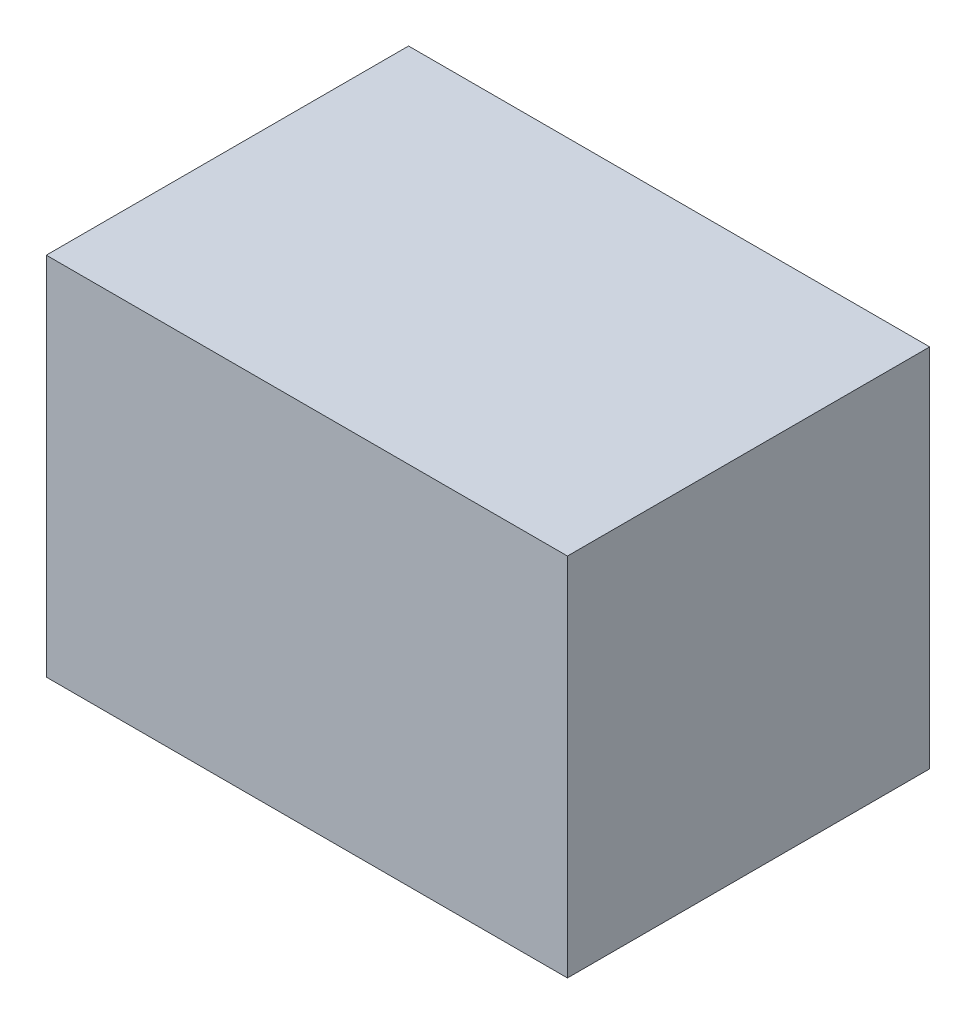
from build123d import *

# Parameters (mm, degrees)
CROQUIS1_W              = 16.4
CROQUIS1_H              = 11.4
SALIENTE_EXTRUIR2_DEPTH = 11.5


with BuildPart() as part:
    # Croquis1 → Saliente-Extruir2 (new body)
    with BuildSketch(Plane(origin=(0, 0, 0), x_dir=(1, 0, 0), z_dir=(0, 1, 0))):
        Rectangle(CROQUIS1_W, CROQUIS1_H)
    extrude(amount=SALIENTE_EXTRUIR2_DEPTH)


solid = part.part
